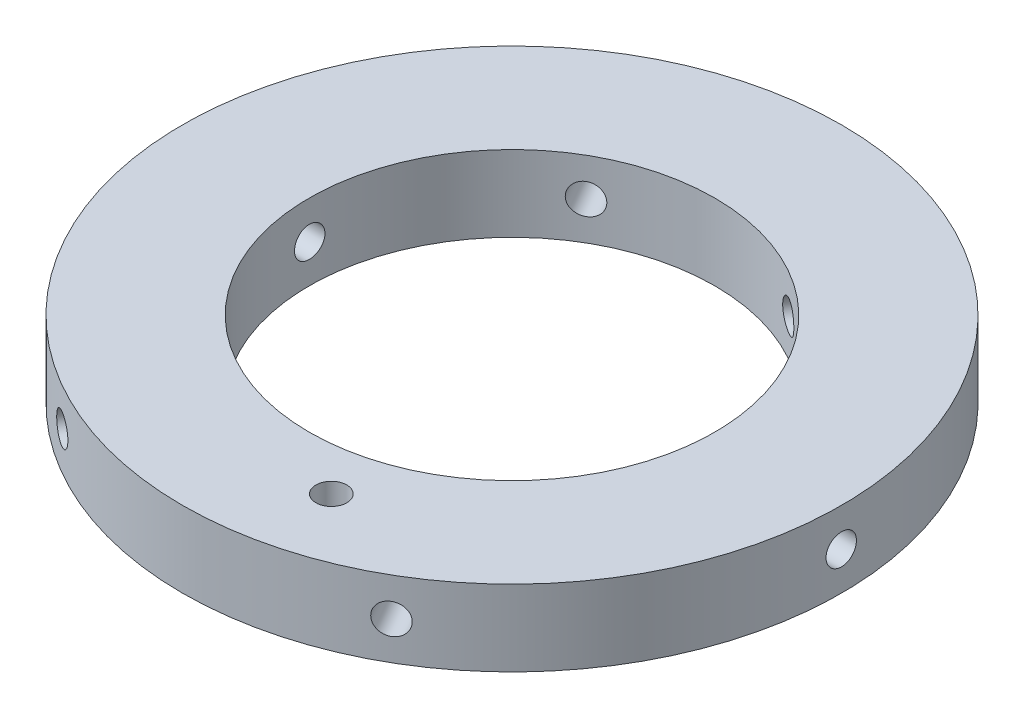
from build123d import *

# Parameters (mm, degrees)
SKETCH1_R           = 65
SKETCH1_R_2         = 40
SKETCH1_R_3         = 3.05
BOSS_EXTRUDE1_DEPTH = 15
SKETCH2_R           = 3
CUT_EXTRUDE1_DEPTH  = 94.139680051
CIRPATTERN1_COUNT   = 6


with BuildPart() as part:
    # Sketch1 → Boss-Extrude1 (new body)
    with BuildSketch(Plane(origin=(0, 0, 0), x_dir=(1, 0, 0), z_dir=(0, 1, 0))):
        with Locations(Location((0, 0, 0), (0, 0, 270))):
            Circle(SKETCH1_R)
        with Locations(Location((0, 0, 0), (0, 0, 270))):
            Circle(SKETCH1_R_2, mode=Mode.SUBTRACT)
        with Locations(Location((12.723046489, -48.354152749, 0), (0, 0, 270))):
            Circle(SKETCH1_R_3, mode=Mode.SUBTRACT)
    extrude(amount=BOSS_EXTRUDE1_DEPTH)

    # Sketch2 → Cut-Extrude1 (cut, through all)
    with BuildSketch(Plane(origin=(0, 0, 0), x_dir=(0, 0, -1), z_dir=(1, 0, 0))):
        with Locations((0, 7.5)):
            Circle(SKETCH2_R)
    cut_extrude1 = extrude(amount=-CUT_EXTRUDE1_DEPTH, mode=Mode.SUBTRACT)

    # CirPattern1: Cut-Extrude1 ×6 about axis
    cirpattern1_axis = Axis((0, 15, 0), (0, 1, 0))
    for i in range(1, CIRPATTERN1_COUNT):
        add(cut_extrude1.rotate(cirpattern1_axis, i * 360 / CIRPATTERN1_COUNT), mode=Mode.SUBTRACT)


solid = part.part
